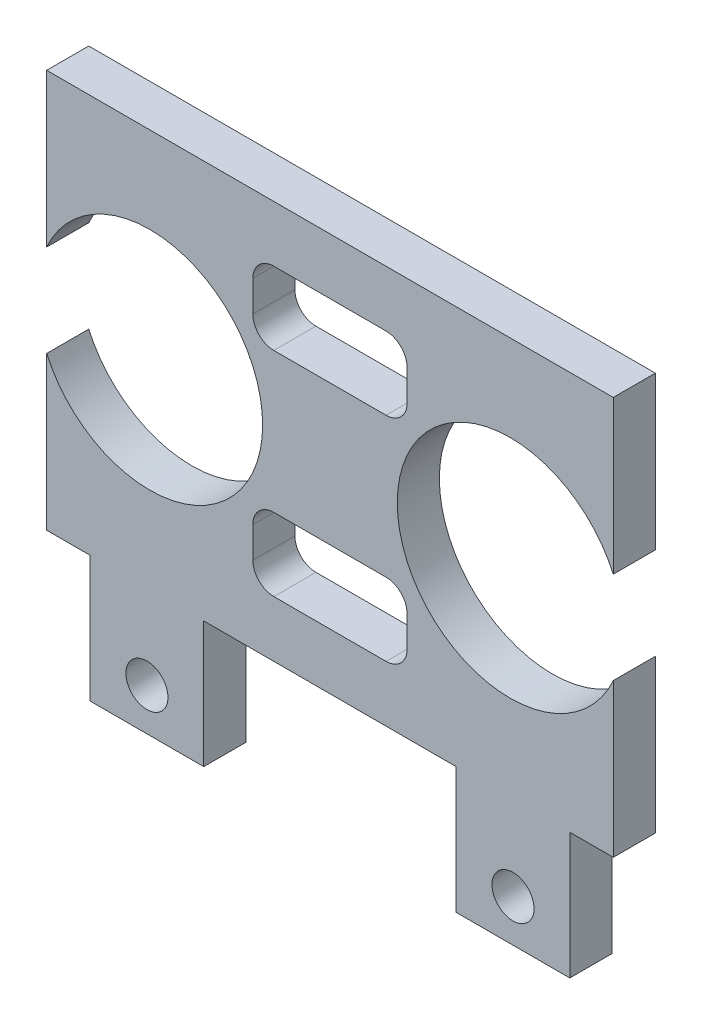
from build123d import *

# Parameters (mm, degrees)
ESBO_O1_R                = 1.5
ESBO_O1_W                = 11
ESBO_O1_H                = 5.2
RESSALTO_EXTRUS_O1_DEPTH = 3
FILETE1_R                = 1.5
FILETE2_R                = 1.5


with BuildPart() as part:
    # Esboço1 → Ressalto-extrusão1 (new body)
    with BuildSketch(Plane.XY):
        with BuildLine():
            Line((0, 10.916708968), (0, 0))
            Line((0, 0), (3.1, 0))
            Line((3.1, 0), (3.1, -9))
            Line((3.1, -9), (11.2, -9))
            Line((11.2, -9), (11.2, 0))
            Line((11.2, 0), (29.2, 0))
            Line((29.2, 0), (29.2, -9))
            Line((29.2, -9), (37.3, -9))
            Line((37.3, -9), (37.3, 0))
            Line((37.3, 0), (40.4, 0))
            Line((40.4, 0), (40.4, 10.916708968))
            ThreePointArc((40.4, 10.916708968), (25, 14.2), (40.4, 17.483291032))
            Line((40.4, 17.483291032), (40.4, 28.4))
            Line((40.4, 28.4), (0, 28.4))
            Line((0, 28.4), (0, 17.483291032))
            ThreePointArc((0, 17.483291032), (9.028541033, 22.073055315), (15.4, 14.2))
            ThreePointArc((15.4, 14.2), (9.028541033, 6.326944685), (0, 10.916708968))
        make_face()
        with Locations((7.15, -6)):
            Circle(ESBO_O1_R, mode=Mode.SUBTRACT)
        with Locations((20.2, 6.6)):
            Rectangle(ESBO_O1_W, ESBO_O1_H, mode=Mode.SUBTRACT)
        with Locations((33.25, -6)):
            Circle(ESBO_O1_R, mode=Mode.SUBTRACT)
        with Locations((20.2, 21.8)):
            Rectangle(ESBO_O1_W, ESBO_O1_H, mode=Mode.SUBTRACT)
    extrude(amount=RESSALTO_EXTRUS_O1_DEPTH)

    # Filete1
    filete1_edges = [part.edges().sort_by_distance(p)[0] for p in [
        (14.7, 24.4, 1.5),
        (14.7, 19.2, 1.5),
        (25.7, 19.2, 1.5),
        (25.7, 24.4, 1.5),
    ]]
    fillet(filete1_edges, radius=FILETE1_R)

    # Filete2
    filete2_edges = [part.edges().sort_by_distance(p)[0] for p in [
        (25.7, 9.2, 1.5),
        (14.7, 9.2, 1.5),
        (14.7, 4, 1.5),
        (25.7, 4, 1.5),
    ]]
    fillet(filete2_edges, radius=FILETE2_R)


solid = part.part
